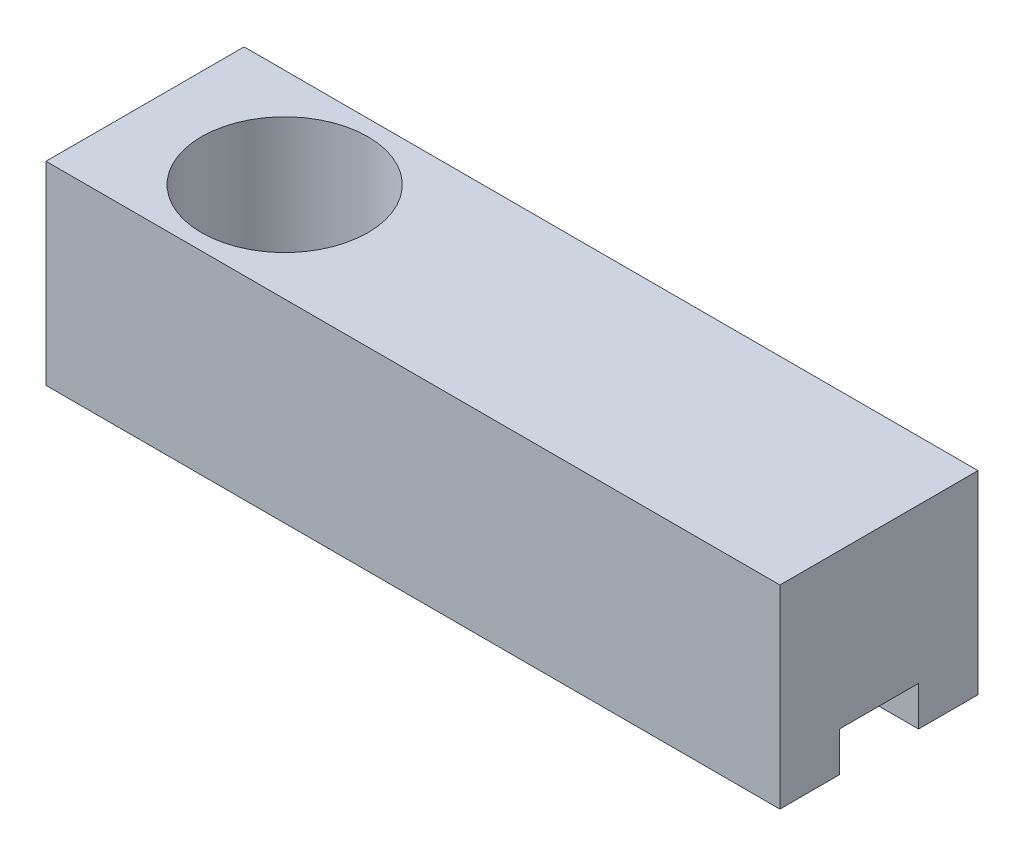
from build123d import *

# Parameters (mm, degrees)
SKETCH1_W           = 100
SKETCH1_H           = 100
BOSS_EXTRUDE1_DEPTH = 50
SKETCH2_R           = 21
CUT_EXTRUDE1_DEPTH  = 87.602540378
SKETCH3_W           = 70
SKETCH3_H           = 50
BOSS_EXTRUDE2_DEPTH = 100
SKETCH4_W           = 100
SKETCH4_H           = 1
CUT_EXTRUDE2_DEPTH  = 213.132034356
SKETCH6_W           = 20
SKETCH6_H           = 10
CUT_EXTRUDE3_DEPTH  = 25
SKETCH7_W           = 10
SKETCH7_H           = 20
CUT_EXTRUDE4_DEPTH  = 10
SKETCH8_W           = 15
SKETCH8_H           = 49
CUT_EXTRUDE5_DEPTH  = 123.069652248
SKETCH9_W           = 14.755371785
SKETCH9_H           = 70
CUT_EXTRUDE6_DEPTH  = 162.635392164
SKETCH10_W          = 10
SKETCH10_H          = 49
CUT_EXTRUDE7_DEPTH  = 195.785965312


with BuildPart() as part:
    # Sketch1 → Boss-Extrude1 (new body)
    with BuildSketch(Plane(origin=(0, 0, 0), x_dir=(1, 0, 0), z_dir=(0, 1, 0))):
        Rectangle(SKETCH1_W, SKETCH1_H)
    extrude(amount=BOSS_EXTRUDE1_DEPTH)

    # Sketch2 → Cut-Extrude1 (cut, through all)
    with BuildSketch(Plane(origin=(0, 50, 0), x_dir=(1, 0, 0), z_dir=(0, 1, 0))):
        with Locations(Location((0, 0, 0), (0, 0, 270))):
            Circle(SKETCH2_R)
    extrude(amount=-CUT_EXTRUDE1_DEPTH, mode=Mode.SUBTRACT)

    # Sketch3 → Boss-Extrude2 (add)
    with BuildSketch(Plane(origin=(50, 0, 0), x_dir=(0, 0, -1), z_dir=(1, 0, 0))):
        with Locations((0, 25)):
            Rectangle(SKETCH3_W, SKETCH3_H)
    extrude(amount=BOSS_EXTRUDE2_DEPTH)

    # Sketch4 → Cut-Extrude2 (cut, through all)
    with BuildSketch(Plane.ZY.offset(50)):
        with Locations((0, 49.5)):
            Rectangle(SKETCH4_W, SKETCH4_H)
    extrude(amount=-CUT_EXTRUDE2_DEPTH, mode=Mode.SUBTRACT)

    # Sketch6 → Cut-Extrude3 (cut)
    with BuildSketch(Plane(origin=(150, 0, 0), x_dir=(0, 0, -1), z_dir=(1, 0, 0))):
        with Locations((0, 5)):
            Rectangle(SKETCH6_W, SKETCH6_H)
    extrude(amount=-CUT_EXTRUDE3_DEPTH, mode=Mode.SUBTRACT)

    # Sketch7 → Cut-Extrude4 (cut)
    with BuildSketch(Plane.XZ.offset(-10)):
        with Locations((130, 0)):
            Rectangle(SKETCH7_W, SKETCH7_H)
    extrude(amount=-CUT_EXTRUDE4_DEPTH, mode=Mode.SUBTRACT)

    # Sketch8 → Cut-Extrude5 (cut, through all)
    with BuildSketch(Plane(origin=(50, 0, 0), x_dir=(0, 0, -1), z_dir=(1, 0, 0))):
        with Locations((42.5, 24.5)):
            Rectangle(SKETCH8_W, SKETCH8_H)
        with Locations((-42.5, 24.5)):
            Rectangle(SKETCH8_W, SKETCH8_H)
    extrude(amount=-CUT_EXTRUDE5_DEPTH, mode=Mode.SUBTRACT)

    # Sketch9 → Cut-Extrude6 (cut, through all)
    with BuildSketch(Plane(origin=(0, 49, 0), x_dir=(1, 0, 0), z_dir=(0, 1, 0))):
        with Locations((-42.622314108, 0)):
            Rectangle(SKETCH9_W, SKETCH9_H)
    extrude(amount=-CUT_EXTRUDE6_DEPTH, mode=Mode.SUBTRACT)

    # Sketch10 → Cut-Extrude7 (cut, through all)
    with BuildSketch(Plane.ZY.offset(35.244628215)):
        with Locations((-30, 24.5)):
            Rectangle(SKETCH10_W, SKETCH10_H)
        with Locations((30, 24.5)):
            Rectangle(SKETCH10_W, SKETCH10_H)
    extrude(amount=-CUT_EXTRUDE7_DEPTH, mode=Mode.SUBTRACT)


solid = part.part
